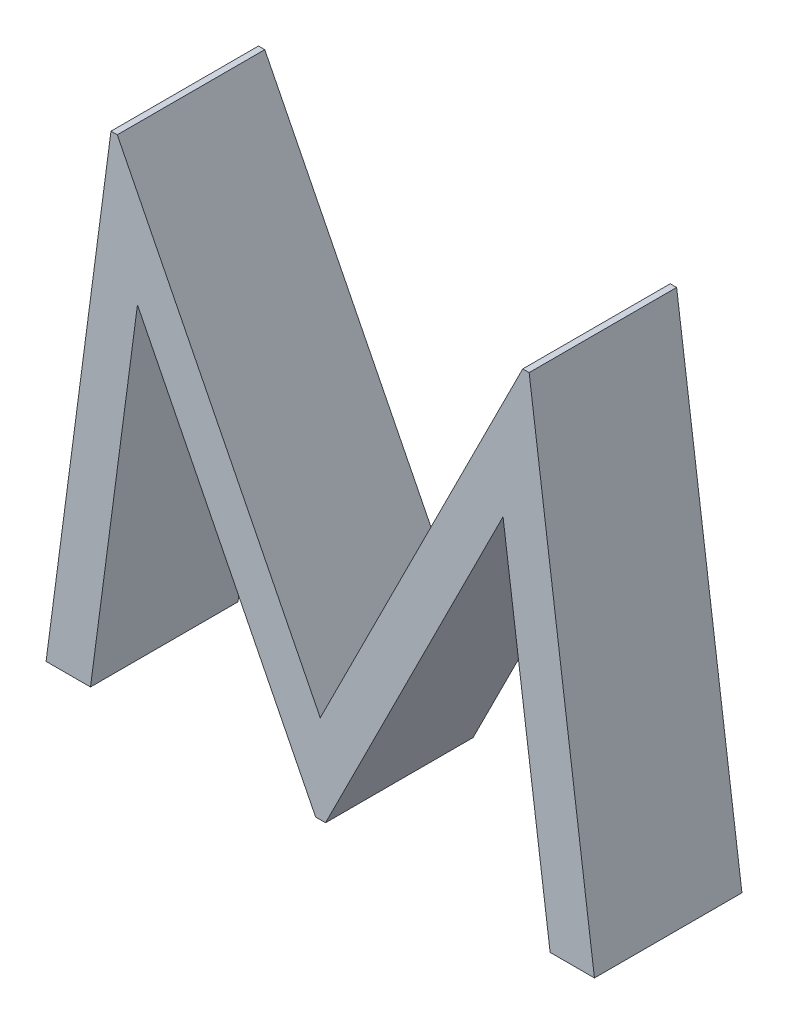
from build123d import *

# Parameters (mm, degrees)
BOSS_EXTRU_1_DEPTH = 1.5


with BuildPart() as part:
    # Esquisse1 → Boss.-Extru.1 (new body)
    with BuildSketch(Plane.XY):
        Polygon((-55.688875582, -22.870119076), (-55.028819493, -17.870119076), (-54.964716928, -17.870119076), (-52.900414044, -21.972683179), (-50.841119172, -17.870119076), (-50.776015005, -17.870119076), (-50.111952505, -22.870119076), (-50.562673659, -22.870119076), (-51.041439685, -19.272362666), (-52.846327505, -22.870119076), (-52.947489364, -22.870119076), (-54.759388403, -19.264349845), (-55.237152826, -22.870119076), align=None)
    extrude(amount=BOSS_EXTRU_1_DEPTH)


solid = part.part
